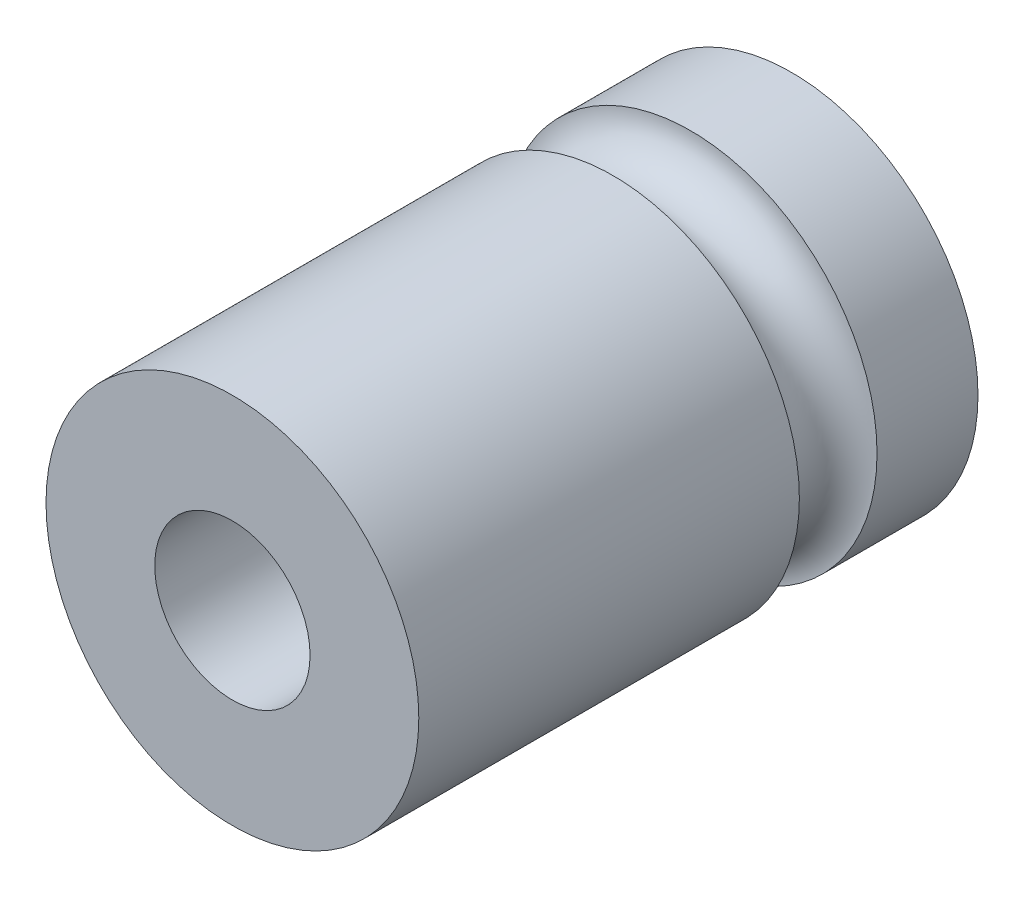
from build123d import *

# Parameters (mm, degrees)
SKETCH1_R           = 3.81
SKETCH1_R_2         = 1.5875
BOSS_EXTRUDE1_DEPTH = 5.715
SKETCH2_R           = 0.79375


with BuildPart() as part:
    # Sketch1 → Boss-Extrude1 (new, symmetric)
    with BuildSketch(Plane.XY):
        Circle(SKETCH1_R)
        Circle(SKETCH1_R_2, mode=Mode.SUBTRACT)
    extrude(amount=BOSS_EXTRUDE1_DEPTH, both=True)

    # Sketch2 → Cut-Revolve1 (revolve, cut)
    with BuildSketch(Plane(origin=(0, 0, 0), x_dir=(1, 0, 0), z_dir=(0, 1, 0))):
        with Locations((3.81, 2.8575)):
            Circle(SKETCH2_R)
    revolve(axis=Axis((0, 0, 5.715), (0, 0, -1)), mode=Mode.SUBTRACT)


solid = part.part
